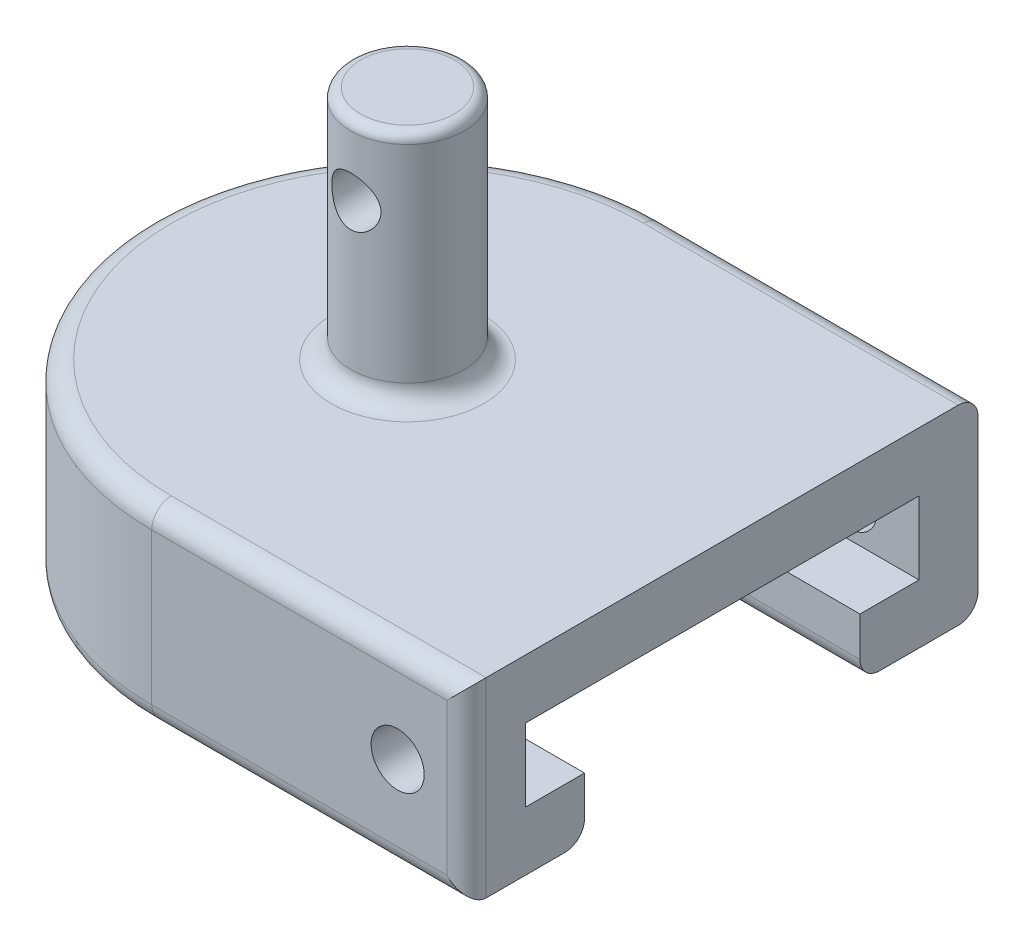
from build123d import *

# Parameters (mm, degrees)
BOSS_EXTRUDE1_DEPTH   = 3
BOSS_EXTRUDE2_DEPTH   = 3.7
BOSS_EXTRUDE3_DEPTH   = 3
SKETCH4_R             = 2.88
BOSS_EXTRUDE4_DEPTH   = 12
F_2_5MM_DOWEL_HOLE1_D = 2.5
SKETCH8_R             = 1.35
CUT_EXTRUDE1_DEPTH    = 38.455173265
FILLET1_R             = 1
FILLET2_R             = 1
FILLET3_R             = 0.5


with BuildPart() as part:
    # Sketch1 → Boss-Extrude1 (new body)
    with BuildSketch(Plane(origin=(0, 0, 0), x_dir=(1, 0, 0), z_dir=(0, 1, 0))):
        with BuildLine():
            Line((0, 13), (16, 13))
            Line((16, 13), (16, 7))
            Line((16, 7), (0, 7))
            ThreePointArc((0, 7), (-7, 0), (0, -7))
            Line((0, -7), (16, -7))
            Line((16, -7), (16, -13))
            Line((16, -13), (0, -13))
            ThreePointArc((0, -13), (-13, 0), (0, 13))
        make_face()
    extrude(amount=BOSS_EXTRUDE1_DEPTH)

    # Sketch2 → Boss-Extrude2 (add)
    with BuildSketch(Plane(origin=(0, 3, 0), x_dir=(1, 0, 0), z_dir=(0, 1, 0))):
        with BuildLine():
            Line((0, 13), (16, 13))
            Line((16, 13), (16, 10))
            Line((16, 10), (0, 10))
            ThreePointArc((0, 10), (-10, 0), (0, -10))
            Line((0, -10), (16, -10))
            Line((16, -10), (16, -13))
            Line((16, -13), (0, -13))
            ThreePointArc((0, -13), (-13, 0), (0, 13))
        make_face()
    extrude(amount=BOSS_EXTRUDE2_DEPTH)

    # Sketch3 → Boss-Extrude3 (add)
    with BuildSketch(Plane(origin=(0, 6.7, 0), x_dir=(1, 0, 0), z_dir=(0, 1, 0))):
        with BuildLine():
            Line((16, 13), (0, 13))
            ThreePointArc((0, 13), (-13, 0), (0, -13))
            Line((0, -13), (16, -13))
            Line((16, -13), (16, -7))
            Line((16, -7), (16, 7))
            Line((16, 7), (16, 13))
        make_face()
    extrude(amount=BOSS_EXTRUDE3_DEPTH)

    # Sketch4 → Boss-Extrude4 (add)
    with BuildSketch(Plane(origin=(0, 9.7, 0), x_dir=(1, 0, 0), z_dir=(0, 1, 0))):
        with Locations(Location((0, 0, 0), (0, 0, 270))):
            Circle(SKETCH4_R)
    extrude(amount=BOSS_EXTRUDE4_DEPTH)

    # Ø2.5mm Dowel Hole1 (through all)
    with Locations(Plane(origin=(-0.002429038, 18.104937254, 2.879998976), x_dir=(0.999999644325, 0, 0.000843415861), z_dir=(-0.000843415861, 0, 0.999999644325))):
        with Locations((0, 0)):
            Hole(F_2_5MM_DOWEL_HOLE1_D / 2)

    # Sketch8 → Cut-Extrude1 (cut, through all)
    with BuildSketch(Plane.XY.offset(13)):
        with Locations((12.5, 4.85)):
            Circle(SKETCH8_R)
    extrude(amount=-CUT_EXTRUDE1_DEPTH, mode=Mode.SUBTRACT)

    # Fillet1
    fillet1_edges = [part.edges().sort_by_distance(p)[0] for p in [
        (8, 0, -13),
        (8, 0, -7),
        (-7, 0, 0),
        (16, 4.85, 13),
        (-13, 9.7, 0),
        (8, 9.7, 13),
        (8, 9.7, -13),
        (8, 0, 7),
        (8, 0, 13),
        (-13, 0, 0),
    ]]
    fillet(fillet1_edges, radius=FILLET1_R)

    # Fillet2
    fillet2_edges = [part.edges().sort_by_distance(p)[0] for p in [
        (0, 9.7, -2.88),
    ]]
    fillet(fillet2_edges, radius=FILLET2_R)

    # Fillet3
    fillet3_edges = [part.edges().sort_by_distance(p)[0] for p in [
        (0, 21.7, -2.88),
    ]]
    fillet(fillet3_edges, radius=FILLET3_R)


solid = part.part
